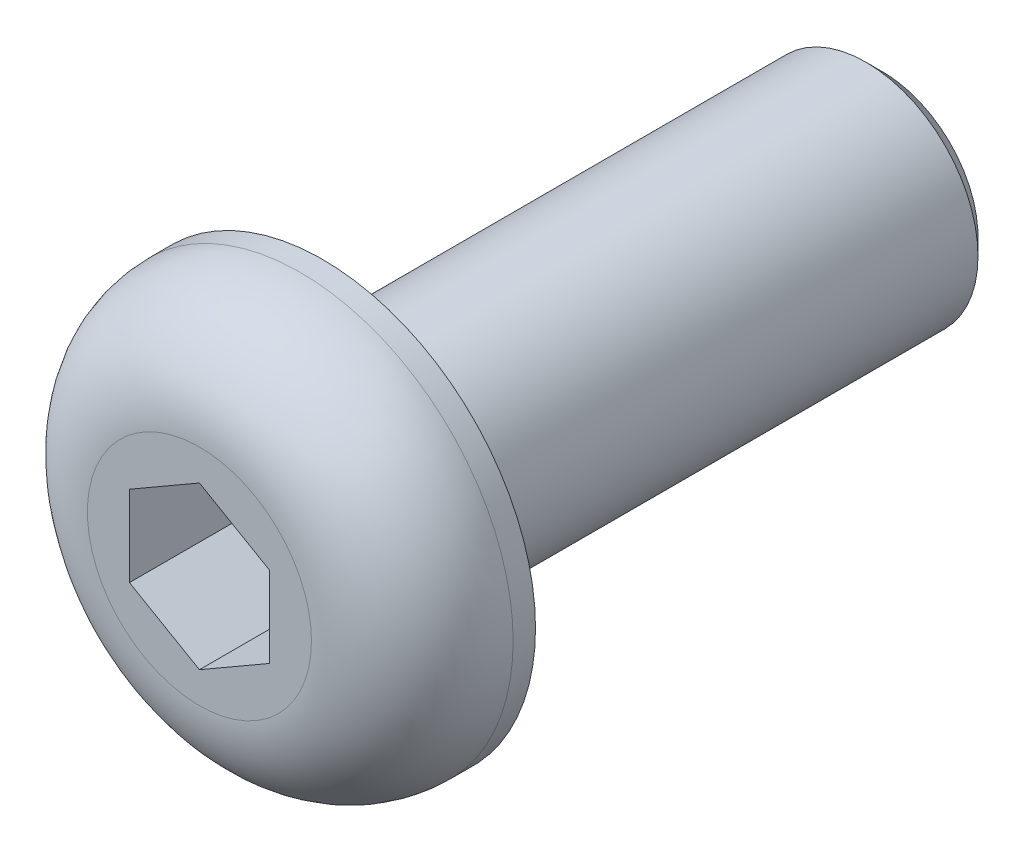
from build123d import *

# Parameters (mm, degrees)
SKETCH1_R           = 3.8
BOSS_EXTRUDE1_DEPTH = 2.2
SKETCH2_R           = 2
BOSS_EXTRUDE2_DEPTH = 10
CHAMFER1_SIZE       = 0.3
CUT_EXTRUDE1_DEPTH  = 2
FILLET1_R           = 1.8


with BuildPart() as part:
    # Sketch1 → Boss-Extrude1 (new body)
    with BuildSketch(Plane.XY):
        Circle(SKETCH1_R)
    extrude(amount=BOSS_EXTRUDE1_DEPTH)

    # Sketch2 → Boss-Extrude2 (add)
    with BuildSketch(Plane(origin=(0, 0, 0), x_dir=(-1, 0, 0), z_dir=(0, 0, -1))):
        with Locations(Location((0, 0, 0), (0, 0, 180))):
            Circle(SKETCH2_R)
    extrude(amount=BOSS_EXTRUDE2_DEPTH)

    # Chamfer1
    chamfer1_edges = [part.edges().sort_by_distance(p)[0] for p in [
        (-2, 0, -10),
    ]]
    chamfer(chamfer1_edges, length=CHAMFER1_SIZE)

    # Sketch3 → Cut-Extrude1 (cut)
    with BuildSketch(Plane.XY.offset(2.2)):
        Polygon((0, 1.443375673), (-1.25, 0.721687836), (-1.25, -0.721687836), (0, -1.443375673), (1.25, -0.721687836), (1.25, 0.721687836), align=None)
    extrude(amount=-CUT_EXTRUDE1_DEPTH, mode=Mode.SUBTRACT)

    # Fillet1
    fillet1_edges = [part.edges().sort_by_distance(p)[0] for p in [
        (-3.8, 0, 2.2),
    ]]
    fillet(fillet1_edges, radius=FILLET1_R)


solid = part.part
